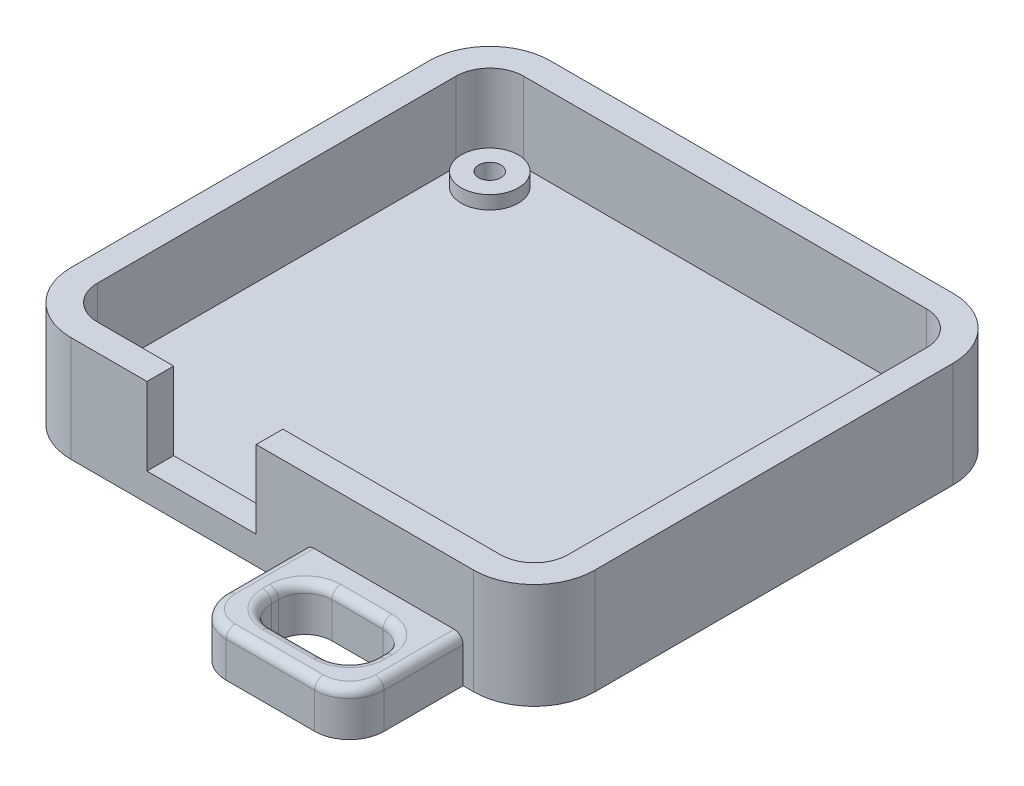
from build123d import *

# Parameters (mm, degrees)
BOSS_EXTRUDE1_DEPTH = 3
CUT_EXTRUDE1_REACH  = 77.661
SKETCH1_3_R         = 1.25
BOSS_EXTRUDE2_START = 8.86
BOSS_EXTRUDE2_DEPTH = 8.86
BOSS_EXTRUDE3_START = 1.5
SKETCH1_5_R         = 3.21
SKETCH1_5_R_2       = 1.25
BOSS_EXTRUDE3_DEPTH = 1.5
SKETCH2_W           = 12.28
SKETCH2_H           = 8.73
CUT_EXTRUDE2_DEPTH  = 3
BOSS_EXTRUDE7_DEPTH = 5
FILLET4_R           = 1


with BuildPart() as part:
    # Sketch1 → Boss-Extrude1 (new body)
    with BuildSketch(Plane(origin=(0, 0, 0), x_dir=(1, 0, 0), z_dir=(0, 1, 0))):
        with BuildLine():
            Line((3.81, 3), (49.09, 3))
            ThreePointArc((49.09, 3), (53.90539718, 1.00539718), (55.9, -3.81))
            Line((55.9, -3.81), (55.9, -44.09))
            ThreePointArc((55.9, -44.09), (53.90539718, -48.90539718), (49.09, -50.9))
            Line((49.09, -50.9), (3.81, -50.9))
            ThreePointArc((3.81, -50.9), (-1.00539718, -48.90539718), (-3, -44.09))
            Line((-3, -44.09), (-3, -3.81))
            ThreePointArc((-3, -3.81), (-1.00539718, 1.00539718), (3.81, 3))
        make_face()
    extrude(amount=-BOSS_EXTRUDE1_DEPTH)

    # Sketch1<3> → Cut-Extrude1 (cut, up to next)
    with BuildSketch(Plane(origin=(0, 0, 0), x_dir=(1, 0, 0), z_dir=(0, 1, 0)), mode=Mode.PRIVATE) as cut_extrude1_sk1:
        with Locations((49.09, -44.09)):
            Circle(SKETCH1_3_R)
    cut_extrude1_tool1 = extrude(cut_extrude1_sk1.sketch, amount=-CUT_EXTRUDE1_REACH, mode=Mode.PRIVATE) & part.part
    # Sketch1<3> → Cut-Extrude1 (cut, up to next)
    with BuildSketch(Plane(origin=(0, 0, 0), x_dir=(1, 0, 0), z_dir=(0, 1, 0)), mode=Mode.PRIVATE) as cut_extrude1_sk2:
        with Locations((3.81, -44.09)):
            Circle(SKETCH1_3_R)
    cut_extrude1_tool2 = extrude(cut_extrude1_sk2.sketch, amount=-CUT_EXTRUDE1_REACH, mode=Mode.PRIVATE) & part.part
    # Sketch1<3> → Cut-Extrude1 (cut, up to next)
    with BuildSketch(Plane(origin=(0, 0, 0), x_dir=(1, 0, 0), z_dir=(0, 1, 0)), mode=Mode.PRIVATE) as cut_extrude1_sk3:
        with Locations((3.81, -3.81)):
            Circle(SKETCH1_3_R)
    cut_extrude1_tool3 = extrude(cut_extrude1_sk3.sketch, amount=-CUT_EXTRUDE1_REACH, mode=Mode.PRIVATE) & part.part
    # Sketch1<3> → Cut-Extrude1 (cut, up to next)
    with BuildSketch(Plane(origin=(0, 0, 0), x_dir=(1, 0, 0), z_dir=(0, 1, 0)), mode=Mode.PRIVATE) as cut_extrude1_sk4:
        with Locations((49.09, -3.81)):
            Circle(SKETCH1_3_R)
    cut_extrude1_tool4 = extrude(cut_extrude1_sk4.sketch, amount=-CUT_EXTRUDE1_REACH, mode=Mode.PRIVATE) & part.part
    add(cut_extrude1_tool1.solids().sort_by_distance((49.09, 0, 44.09))[0], mode=Mode.SUBTRACT)
    add(cut_extrude1_tool2.solids().sort_by_distance((3.81, 0, 44.09))[0], mode=Mode.SUBTRACT)
    add(cut_extrude1_tool3.solids().sort_by_distance((3.81, 0, 3.81))[0], mode=Mode.SUBTRACT)
    add(cut_extrude1_tool4.solids().sort_by_distance((49.09, 0, 3.81))[0], mode=Mode.SUBTRACT)

    # Sketch1<4> → Boss-Extrude2 (add)
    with BuildSketch(Plane(origin=(0, 0, 0), x_dir=(1, 0, 0), z_dir=(0, 1, 0)).offset(BOSS_EXTRUDE2_START)):
        with BuildLine():
            Line((49.09, 3), (3.81, 3))
            ThreePointArc((3.81, 3), (-1.00539718, 1.00539718), (-3, -3.81))
            Line((-3, -3.81), (-3, -44.09))
            ThreePointArc((-3, -44.09), (-1.00539718, -48.90539718), (3.81, -50.9))
            Line((3.81, -50.9), (49.09, -50.9))
            ThreePointArc((49.09, -50.9), (53.90539718, -48.90539718), (55.9, -44.09))
            Line((55.9, -44.09), (55.9, -3.81))
            ThreePointArc((55.9, -3.81), (53.90539718, 1.00539718), (49.09, 3))
        make_face()
        with BuildLine():
            ThreePointArc((0, -3.81), (1.115923164, -1.115923164), (3.81, 0))
            Line((3.81, 0), (49.09, 0))
            ThreePointArc((49.09, 0), (51.784076836, -1.115923164), (52.9, -3.81))
            Line((52.9, -3.81), (52.9, -44.09))
            ThreePointArc((52.9, -44.09), (51.784076836, -46.784076836), (49.09, -47.9))
            Line((49.09, -47.9), (3.81, -47.9))
            ThreePointArc((3.81, -47.9), (1.115923164, -46.784076836), (0, -44.09))
            Line((0, -44.09), (0, -3.81))
        make_face(mode=Mode.SUBTRACT)
    extrude(amount=-BOSS_EXTRUDE2_DEPTH)

    # Sketch1<5> → Boss-Extrude3 (add)
    # profile 1 of 4: a face of its own
    with BuildSketch(Plane(origin=(0, 0, 0), x_dir=(1, 0, 0), z_dir=(0, 1, 0)).offset(BOSS_EXTRUDE3_START)):
        with Locations((3.81, -3.81)):
            Circle(SKETCH1_5_R)
        with Locations((3.81, -3.81)):
            Circle(SKETCH1_5_R_2, mode=Mode.SUBTRACT)
    # profile 2 of 4: a face of its own
    with BuildSketch(Plane(origin=(0, 0, 0), x_dir=(1, 0, 0), z_dir=(0, 1, 0)).offset(BOSS_EXTRUDE3_START)):
        with Locations((49.09, -3.81)):
            Circle(SKETCH1_5_R)
        with Locations((49.09, -3.81)):
            Circle(SKETCH1_5_R_2, mode=Mode.SUBTRACT)
    # profile 3 of 4: a face of its own
    with BuildSketch(Plane(origin=(0, 0, 0), x_dir=(1, 0, 0), z_dir=(0, 1, 0)).offset(BOSS_EXTRUDE3_START)):
        with Locations((49.09, -44.09)):
            Circle(SKETCH1_5_R)
        with Locations((49.09, -44.09)):
            Circle(SKETCH1_5_R_2, mode=Mode.SUBTRACT)
    # profile 4 of 4: a face of its own
    with BuildSketch(Plane(origin=(0, 0, 0), x_dir=(1, 0, 0), z_dir=(0, 1, 0)).offset(BOSS_EXTRUDE3_START)):
        with Locations((3.81, -44.09)):
            Circle(SKETCH1_5_R)
        with Locations((3.81, -44.09)):
            Circle(SKETCH1_5_R_2, mode=Mode.SUBTRACT)
    extrude(amount=-BOSS_EXTRUDE3_DEPTH)

    # Sketch2 → Cut-Extrude2 (cut)
    with BuildSketch(Plane.XY.offset(50.9)):
        with Locations((18.5, 4.5)):
            Rectangle(SKETCH2_W, SKETCH2_H)
    extrude(amount=-CUT_EXTRUDE2_DEPTH, mode=Mode.SUBTRACT)

    # Sketch8 → Boss-Extrude7 (add)
    with BuildSketch(Plane.XZ.offset(3)):
        with BuildLine():
            Line((47.9, 50.9), (30.15, 50.9))
            Line((30.15, 50.9), (30.15, 59.78))
            ThreePointArc((30.15, 59.78), (31.292283553, 62.537716447), (34.05, 63.68))
            Line((34.05, 63.68), (44, 63.68))
            ThreePointArc((44, 63.68), (46.757716447, 62.537716447), (47.9, 59.78))
            Line((47.9, 59.78), (47.9, 50.9))
        make_face()
        with BuildLine():
            Line((41.9, 53.9), (36.15, 53.9))
            ThreePointArc((36.15, 53.9), (34.028679656, 54.778679656), (33.15, 56.9))
            Line((33.15, 56.9), (33.15, 57.68))
            ThreePointArc((33.15, 57.68), (34.028679656, 59.801320344), (36.15, 60.68))
            Line((36.15, 60.68), (41.9, 60.68))
            ThreePointArc((41.9, 60.68), (44.021320344, 59.801320344), (44.9, 57.68))
            Line((44.9, 57.68), (44.9, 56.9))
            ThreePointArc((44.9, 56.9), (44.021320344, 54.778679656), (41.9, 53.9))
        make_face(mode=Mode.SUBTRACT)
    extrude(amount=-BOSS_EXTRUDE7_DEPTH)

    # Fillet4
    fillet4_edges = [part.edges().sort_by_distance(p)[0] for p in [
        (47.9, 2, 55.34),
        (46.757716447, 2, 62.537716447),
        (39.025, 2, 63.68),
        (31.292283553, 2, 62.537716447),
        (33.15, 2, 57.29),
        (34.028679656, 2, 59.801320344),
        (39.025, 2, 60.68),
        (44.021320344, 2, 59.801320344),
        (44.9, 2, 57.29),
        (44.021320344, 2, 54.778679656),
        (39.025, 2, 53.9),
        (30.15, 2, 55.34),
        (34.028679656, 2, 54.778679656),
    ]]
    fillet(fillet4_edges, radius=FILLET4_R)


solid = part.part
